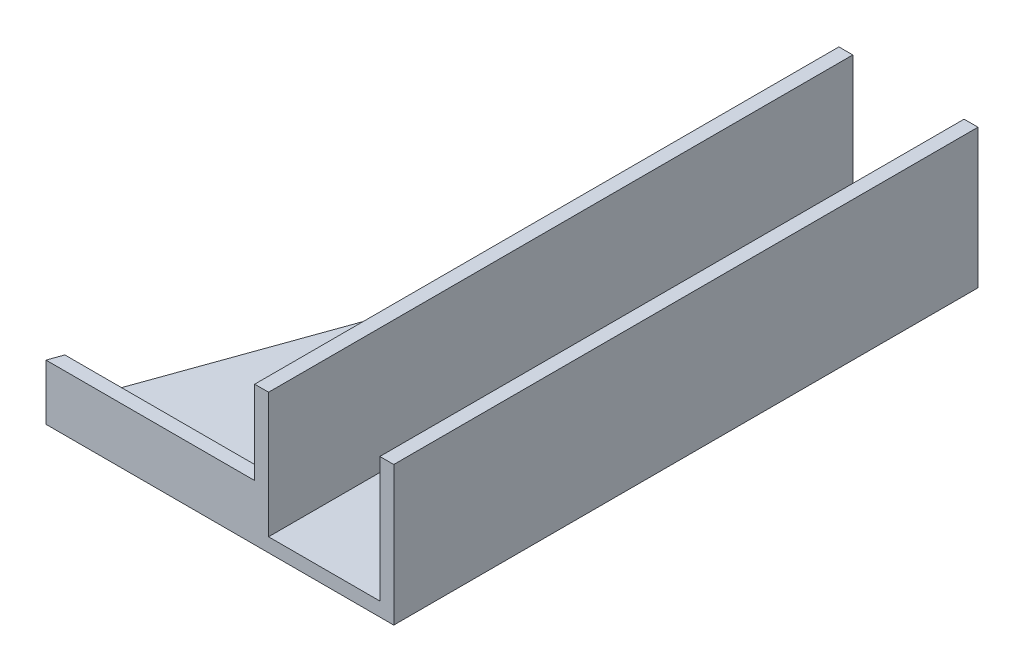
from build123d import *

# Parameters (mm, degrees)
BOSS_EXTRUDE1_DEPTH = 5
BOSS_EXTRUDE2_DEPTH = 15
SKETCH3_W           = 50
SKETCH3_H           = 210
BOSS_EXTRUDE3_DEPTH = 50
SKETCH4_W           = 40
SKETCH4_H           = 45
CUT_EXTRUDE2_DEPTH  = 210


with BuildPart() as part:
    # Sketch1 → Boss-Extrude1 (new body)
    with BuildSketch(Plane(origin=(0, 0, 0), x_dir=(1, 0, 0), z_dir=(0, 1, 0))):
        Polygon((-37.5, -105), (37.5, 105), (37.5, -105), align=None)
    extrude(amount=BOSS_EXTRUDE1_DEPTH)

    # Sketch2 → Boss-Extrude2 (add)
    with BuildSketch(Plane(origin=(0, 5, 0), x_dir=(1, 0, 0), z_dir=(0, 1, 0))):
        Polygon((-37.5, -105), (37.5, -105), (37.5, -100), (-35.714285714, -100), align=None)
    extrude(amount=BOSS_EXTRUDE2_DEPTH)

    # Sketch3 → Boss-Extrude3 (add)
    with BuildSketch(Plane.XZ):
        with Locations((62.5, 0)):
            Rectangle(SKETCH3_W, SKETCH3_H)
    extrude(amount=-BOSS_EXTRUDE3_DEPTH)

    # Sketch4 → Cut-Extrude2 (cut)
    with BuildSketch(Plane(origin=(0, 0, -105), x_dir=(-1, 0, 0), z_dir=(0, 0, -1))):
        with Locations((-62.5, 27.5)):
            Rectangle(SKETCH4_W, SKETCH4_H)
    extrude(amount=-CUT_EXTRUDE2_DEPTH, mode=Mode.SUBTRACT)


solid = part.part
